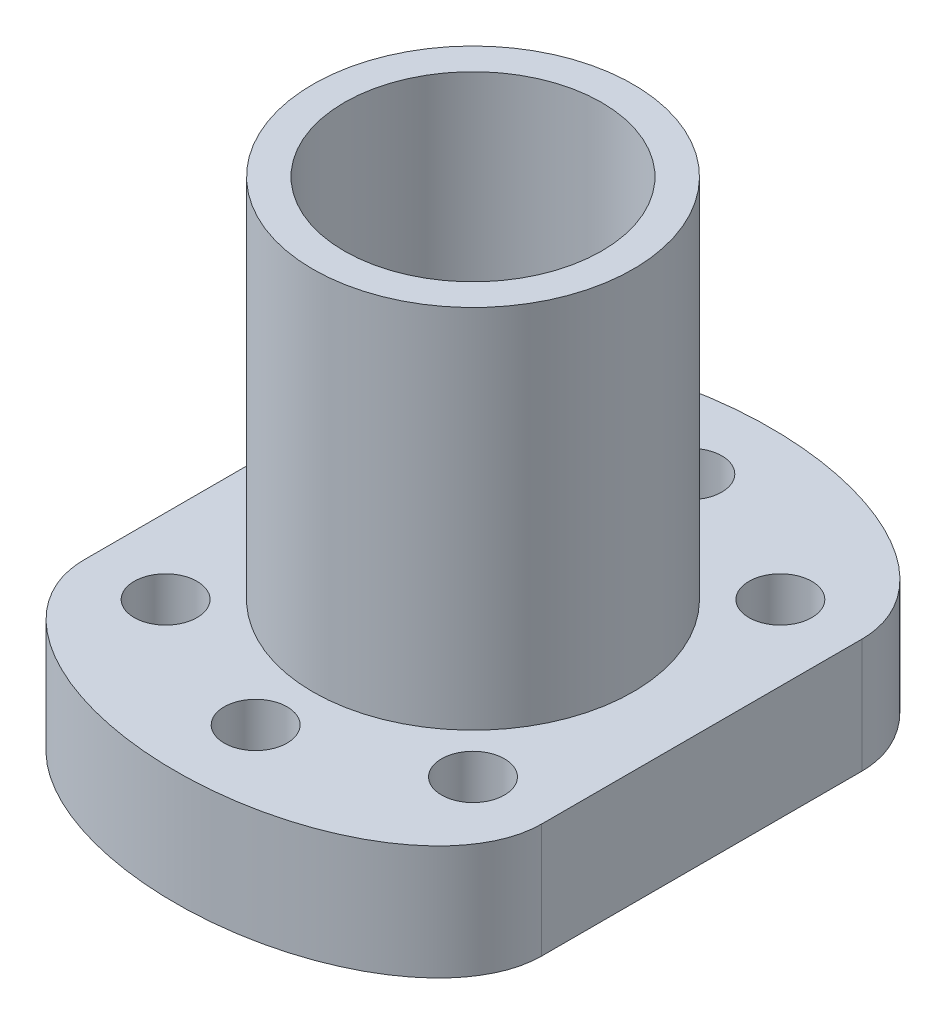
from build123d import *

# Parameters (mm, degrees)
BOSS_EXTRUDE1_DEPTH = 10
SKETCH2_R           = 14
BOSS_EXTRUDE2_DEPTH = 32
SKETCH3_R           = 11.25
CUT_EXTRUDE1_DEPTH  = 78.897368549
SKETCH4_R           = 2.75
CUT_EXTRUDE2_DEPTH  = 73.99315049


with BuildPart() as part:
    # Sketch1 → Boss-Extrude1 (new body)
    with BuildSketch(Plane(origin=(0, 0, 0), x_dir=(1, 0, 0), z_dir=(0, 1, 0))):
        with BuildLine():
            Line((0, 40), (0, 12))
            add(Edge.make_bspline(
                [(0, 12), (0, 0), (20, 0), (40, 0), (40, 12)],
                knots=[3.141592654, 3.141592654, 3.141592654, 4.71238898, 4.71238898, 6.283185307, 6.283185307, 6.283185307], degree=2, weights=[1, 0.707106781, 1, 0.707106781, 1]))
            Line((40, 12), (40, 40))
            add(Edge.make_bspline(
                [(40, 40), (40, 52), (20, 52), (0, 52), (0, 40)],
                knots=[3.141592654, 3.141592654, 3.141592654, 4.71238898, 4.71238898, 6.283185307, 6.283185307, 6.283185307], degree=2, weights=[1, 0.707106781, 1, 0.707106781, 1]))
        make_face()
    extrude(amount=BOSS_EXTRUDE1_DEPTH)

    # Sketch2 → Boss-Extrude2 (add)
    with BuildSketch(Plane(origin=(0, 10, 0), x_dir=(1, 0, 0), z_dir=(0, 1, 0))):
        with Locations(Location((20, 26, 0), (0, 0, 270))):
            Circle(SKETCH2_R)
    extrude(amount=BOSS_EXTRUDE2_DEPTH)

    # Sketch3 → Cut-Extrude1 (cut, through all)
    with BuildSketch(Plane(origin=(0, 42, 0), x_dir=(1, 0, 0), z_dir=(0, 1, 0))):
        with Locations(Location((20, 26, 0), (0, 0, 270))):
            Circle(SKETCH3_R)
    extrude(amount=-CUT_EXTRUDE1_DEPTH, mode=Mode.SUBTRACT)

    # Sketch4 → Cut-Extrude2 (cut, through all)
    with BuildSketch(Plane(origin=(0, 10, 0), x_dir=(1, 0, 0), z_dir=(0, 1, 0))):
        with Locations(Location((20, 45, 0), (0, 0, 270))):
            Circle(SKETCH4_R)
        with Locations(Location((33.435028843, 39.435028843, 0), (0, 0, 270))):
            Circle(SKETCH4_R)
        with Locations(Location((6.564971157, 39.435028843, 0), (0, 0, 270))):
            Circle(SKETCH4_R)
        with Locations(Location((20, 7, 0), (0, 0, 270))):
            Circle(SKETCH4_R)
        with Locations(Location((33.435028843, 12.564971157, 0), (0, 0, 270))):
            Circle(SKETCH4_R)
        with Locations(Location((6.564971157, 12.564971157, 0), (0, 0, 270))):
            Circle(SKETCH4_R)
    extrude(amount=-CUT_EXTRUDE2_DEPTH, mode=Mode.SUBTRACT)


solid = part.part
